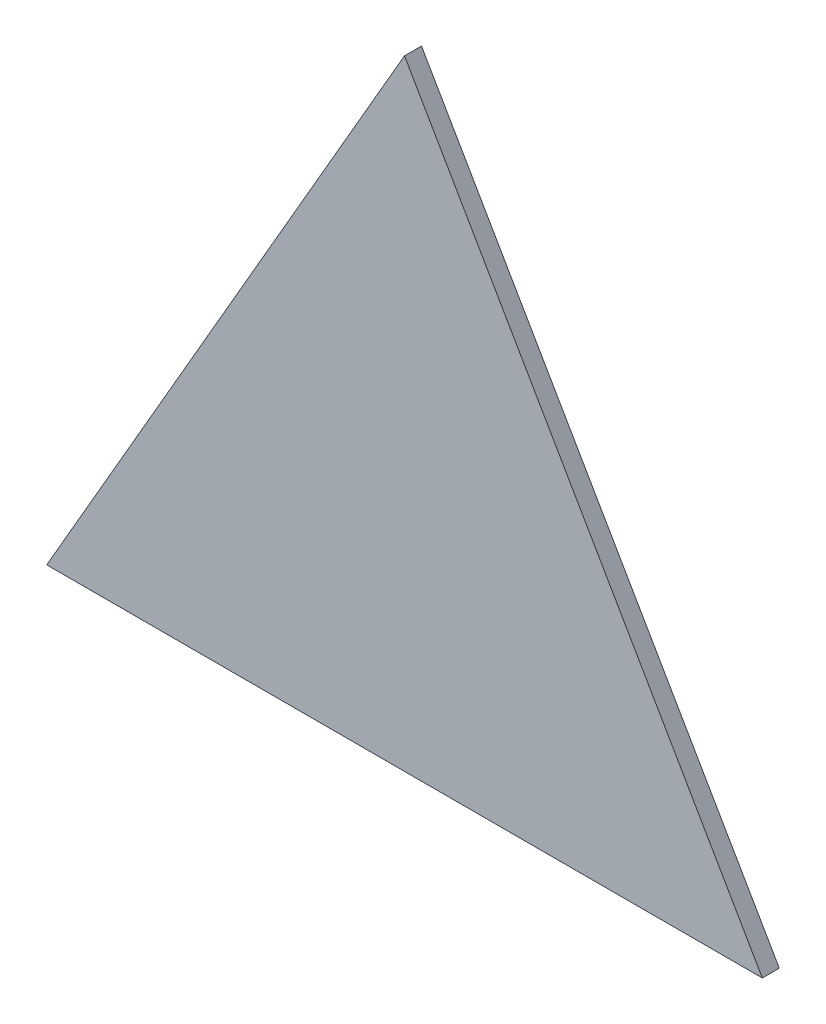
from build123d import *

# Parameters (mm, degrees)
BOSS_EXTRUDE1_DEPTH = 2


with BuildPart() as part:
    # Sketch1 → Boss-Extrude1 (new body)
    with BuildSketch(Plane.XY):
        Polygon((0, 36.5), (-42.146569651, -36.5), (42.146569651, -36.5), align=None)
    extrude(amount=BOSS_EXTRUDE1_DEPTH)


solid = part.part
